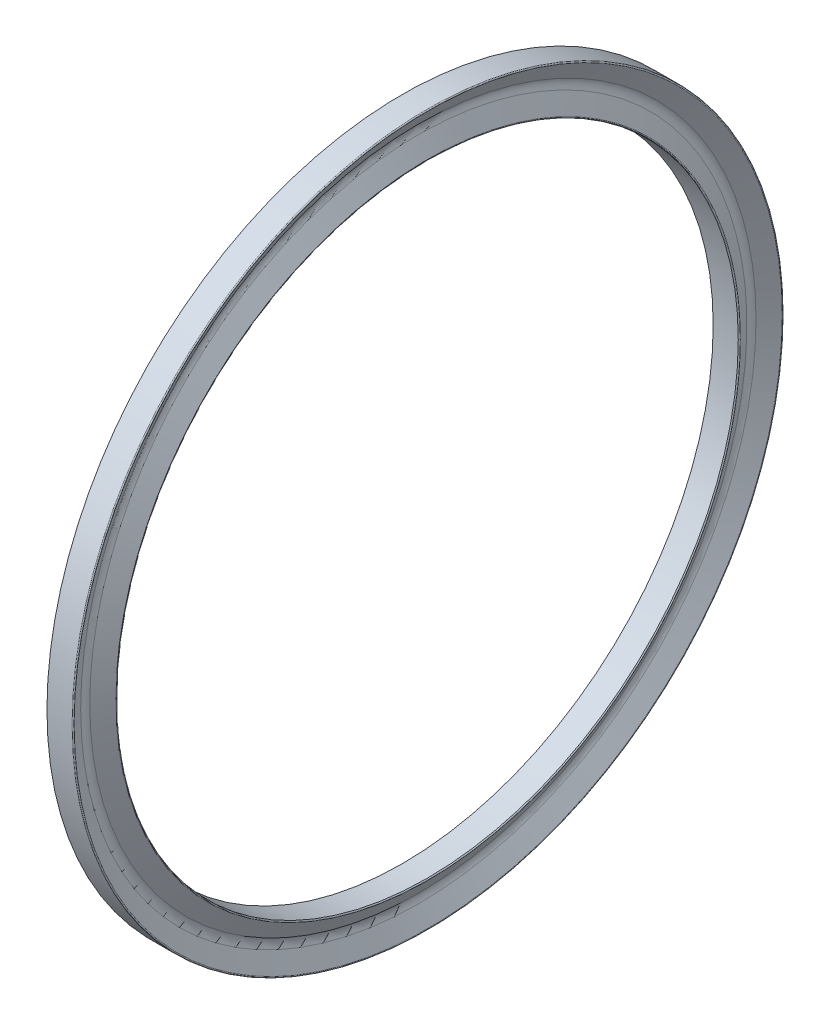
from build123d import *


with BuildPart() as part:
    # Sketch1 → Revolve1 (revolve)
    with BuildSketch(Plane.XY, mode=Mode.PRIVATE) as revolve1_sk:
        with BuildLine():
            Line((-22.415404975, -40), (-19.592024013, -40))
            ThreePointArc((-19.592024013, -40), (-19.505004023, -39.949269881), (-19.506274721, -39.848550424))
            Line((-19.506274721, -39.848550424), (-20.606707522, -38.014495755))
            ThreePointArc((-20.606707522, -38.014495755), (-20.749214596, -37.5), (-20.606707522, -36.985504245))
            Line((-20.606707522, -36.985504245), (-19.506274721, -35.151449576))
            ThreePointArc((-19.506274721, -35.151449576), (-19.505004023, -35.050730119), (-19.592024013, -35))
            Line((-19.592024013, -35), (-22.415404975, -35))
            Line((-22.415404975, -35), (-22.415404975, -40))
        make_face()
    revolve(revolve1_sk.sketch.rotate(Axis((-74.757250499, 0, 0), (1, 0, 0)), 270), axis=Axis((-74.757250499, 0, 0), (1, 0, 0)))


solid = part.part
